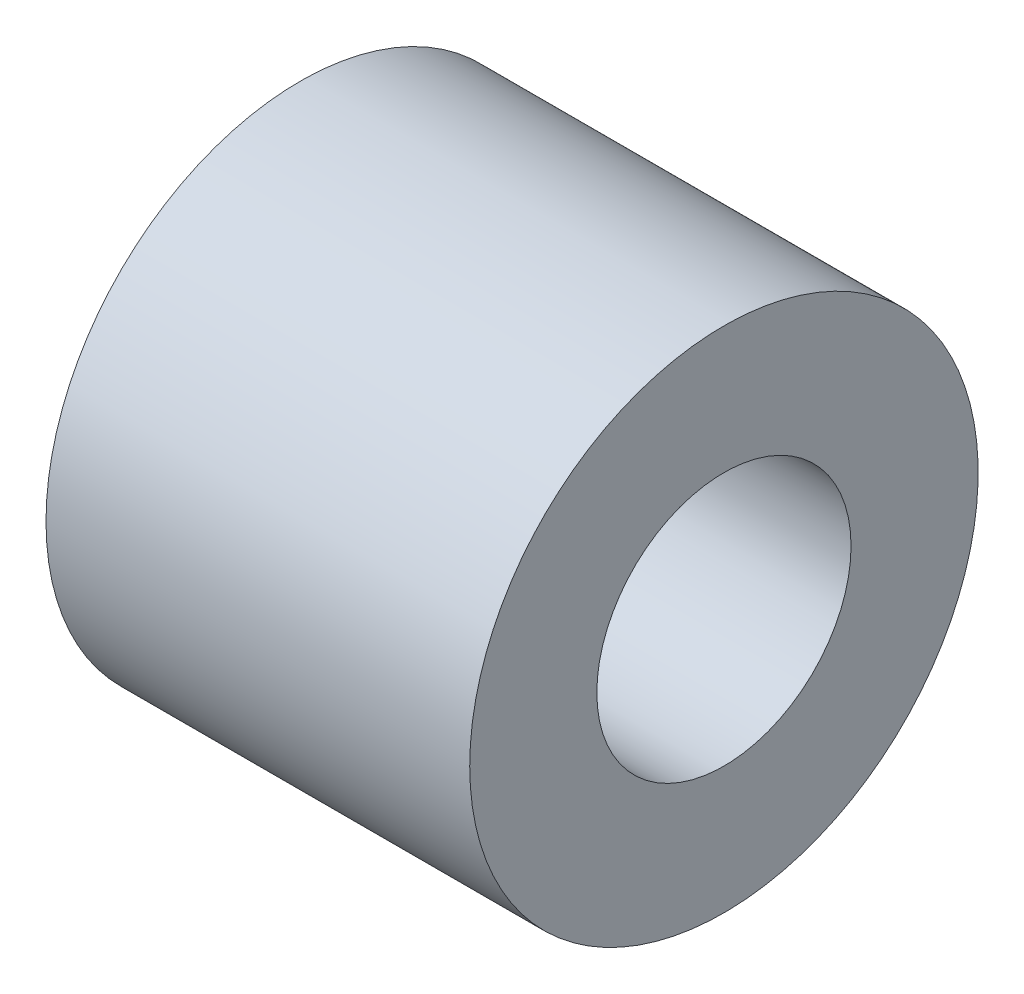
from build123d import *

# Parameters (mm, degrees)
STEM_COUPLER_SKETCH_W = 10
STEM_COUPLER_SKETCH_H = 3


with BuildPart() as part:
    # Stem_Coupler Sketch → Stem_Coupler (revolve)
    with BuildSketch(Plane.XY):
        with Locations((5, 4.5)):
            Rectangle(STEM_COUPLER_SKETCH_W, STEM_COUPLER_SKETCH_H)
    revolve(axis=Axis((-1000, 0, 0), (1, 0, 0)))


solid = part.part
